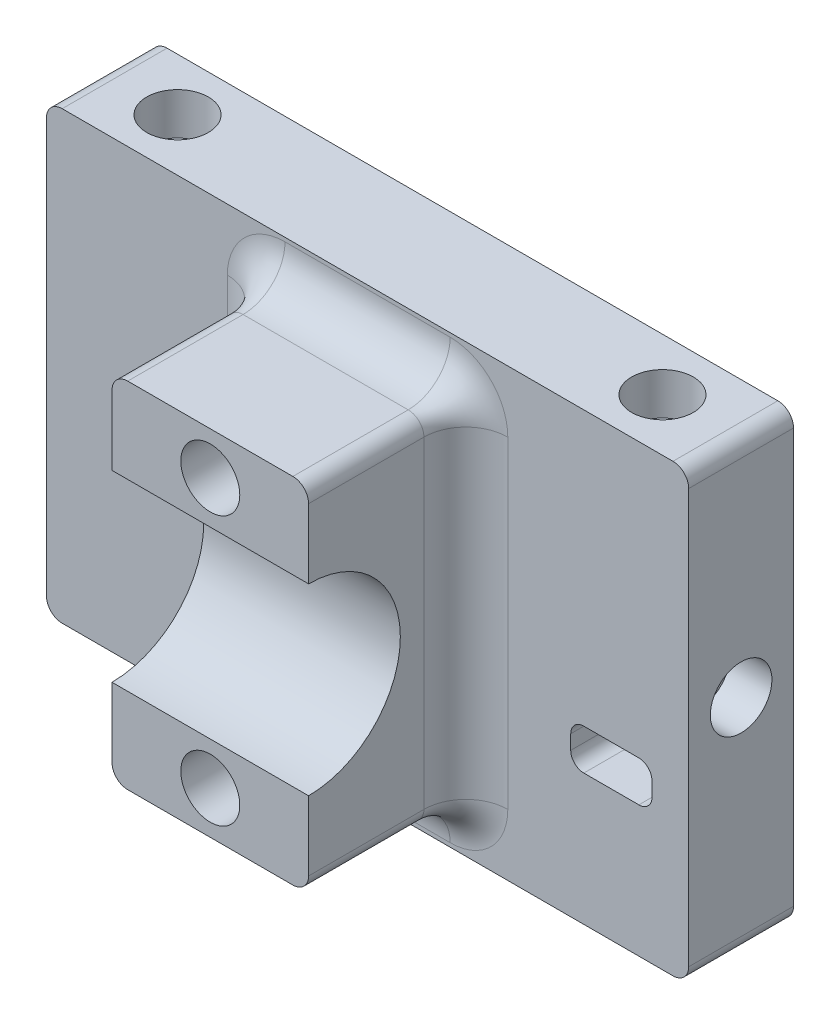
from build123d import *

# Parameters (mm, degrees)
ESQUISSE1_W                = 49
ESQUISSE1_H                = 34
BASE_DEPTH                 = 8
ESQUISSE2_R                = 2.35
INSERT_M3_L_DEPTH          = 3.2
INSERT_M3_R_START          = -3.2
ESQUISSE3_R                = 2.35
INSERT_M3_R_DEPTH          = 3.2
ESQUISSE4_R                = 2.35
INSERT_M3_TOP_DEPTH        = 3.2
INSER_M3_BOT_START         = 3.2
ESQUISSE5_R                = 2.35
INSER_M3_BOT_DEPTH         = 3.2
ESQUISSE11_R               = 1.5
PASSAGE_VIS_L_DEPTH        = 5
PASSAGE_VIS_R_START        = -5
ESQUISSE12_R               = 1.5
PASSAGE_VIS_R_DEPTH        = 5
ESQUISSE10_R               = 1.5
PASSAGE_VIS_TOP_DEPTH      = 5
PASSAGE_VIS_BOT_START      = -5
ESQUISSE13_R               = 1.5
PASSAGE_VIS_BOT_DEPTH      = 5
CONG_1_R                   = 1.2
ESQUISSE6_W                = 15
ESQUISSE6_H                = 27
SUPPORT_FIXATION_DEPTH     = 12
PASSAGE_GUIDON_REACH       = 43.388
CONG_VERTICAL_R            = 1.2
CONG_BASE_R                = 3.2
ESQUISSE8_R                = 2.25
INSERTS_M3_FIXATION_DEPTH  = 3.2
ESQUISSE9_R                = 1.5
PASSAGE_VIS_FIXATION_DEPTH = 5
PASSE_CABLE_DEPTH          = 8


with BuildPart() as part:
    # Esquisse1 → Base (new body)
    with BuildSketch(Plane.XY):
        Rectangle(ESQUISSE1_W, ESQUISSE1_H)
    extrude(amount=BASE_DEPTH)

    # Esquisse2 → Insert_M3_L (cut)
    with BuildSketch(Plane.ZY.offset(24.5)):
        with Locations(Location((4, 0, 0), (0, 0, 270))):
            Circle(ESQUISSE2_R)
    extrude(amount=-INSERT_M3_L_DEPTH, mode=Mode.SUBTRACT)

    # Esquisse3 → Insert_M3_R (cut)
    with BuildSketch(Plane(origin=(24.5, 0, 0), x_dir=(0, 0, -1), z_dir=(1, 0, 0)).offset(INSERT_M3_R_START)):
        with Locations(Location((-4, 0, 0), (0, 0, 270))):
            Circle(ESQUISSE3_R)
    extrude(amount=INSERT_M3_R_DEPTH, mode=Mode.SUBTRACT)

    # Esquisse4 → Insert_M3_TOP (cut)
    with BuildSketch(Plane(origin=(0, 17, 0), x_dir=(1, 0, 0), z_dir=(0, 1, 0))):
        with Locations(Location((-18.5, -4, 0), (0, 0, 180))):
            Circle(ESQUISSE4_R)
        with Locations(Location((18.5, -4, 0), (0, 0, 180))):
            Circle(ESQUISSE4_R)
    extrude(amount=-INSERT_M3_TOP_DEPTH, mode=Mode.SUBTRACT)

    # Esquisse5 → Inser_M3_BOT (cut)
    with BuildSketch(Plane(origin=(0, -17, -17), x_dir=(1, 0, 0), z_dir=(0, 1, 0)).offset(INSER_M3_BOT_START)):
        with Locations(Location((-18.5, -21, 0), (0, 0, 180))):
            Circle(ESQUISSE5_R)
        with Locations(Location((18.5, -21, 0), (0, 0, 180))):
            Circle(ESQUISSE5_R)
    extrude(amount=-INSER_M3_BOT_DEPTH, mode=Mode.SUBTRACT)

    # Esquisse11 → Passage_Vis_L (cut)
    with BuildSketch(Plane.ZY.offset(21.3)):
        with Locations(Location((4, 0, 0), (0, 0, 270))):
            Circle(ESQUISSE11_R)
    extrude(amount=-PASSAGE_VIS_L_DEPTH, mode=Mode.SUBTRACT)

    # Esquisse12 → Passage_Vis_R (cut)
    with BuildSketch(Plane(origin=(21.3, 0, 0), x_dir=(0, 0, -1), z_dir=(1, 0, 0)).offset(PASSAGE_VIS_R_START)):
        with Locations(Location((-4, 0, 0), (0, 0, 270))):
            Circle(ESQUISSE12_R)
    extrude(amount=PASSAGE_VIS_R_DEPTH, mode=Mode.SUBTRACT)

    # Esquisse10 → Passage_Vis_TOP (cut)
    with BuildSketch(Plane(origin=(0, 13.8, 0), x_dir=(1, 0, 0), z_dir=(0, 1, 0))):
        with Locations(Location((-18.5, -4, 0), (0, 0, 180))):
            Circle(ESQUISSE10_R)
        with Locations(Location((18.5, -4, 0), (0, 0, 180))):
            Circle(ESQUISSE10_R)
    extrude(amount=-PASSAGE_VIS_TOP_DEPTH, mode=Mode.SUBTRACT)

    # Esquisse13 → Passage_Vis_BOT (cut)
    with BuildSketch(Plane.XZ.offset(13.8).offset(PASSAGE_VIS_BOT_START)):
        with Locations(Location((-18.5, 4, 0), (0, 0, 180))):
            Circle(ESQUISSE13_R)
        with Locations(Location((18.5, 4, 0), (0, 0, 180))):
            Circle(ESQUISSE13_R)
    extrude(amount=PASSAGE_VIS_BOT_DEPTH, mode=Mode.SUBTRACT)

    # Congé1
    cong_1_edges = [part.edges().sort_by_distance(p)[0] for p in [
        (-24.5, 17, 4),
        (24.5, 17, 4),
        (24.5, -17, 4),
        (-24.5, -17, 4),
    ]]
    fillet(cong_1_edges, radius=CONG_1_R)

    # Esquisse6 → Support_Fixation (add)
    with BuildSketch(Plane.XY.offset(8)):
        Rectangle(ESQUISSE6_W, ESQUISSE6_H)
    extrude(amount=SUPPORT_FIXATION_DEPTH)

    # Esquisse7 → Passage_Guidon (cut, up to next)
    with BuildSketch(Plane.ZY.offset(7.5), mode=Mode.PRIVATE) as passage_guidon_sk1:
        with BuildLine():
            Line((20, 7), (20, -7))
            ThreePointArc((20, -7), (13, 0), (20, 7))
        make_face()
    passage_guidon_tool1 = extrude(passage_guidon_sk1.sketch, amount=-PASSAGE_GUIDON_REACH, mode=Mode.PRIVATE) & part.part
    add(passage_guidon_tool1.solids().sort_by_distance((-7.5, 0, 17.029108))[0], mode=Mode.SUBTRACT)

    # Congé_Vertical
    cong_vertical_edges = [part.edges().sort_by_distance(p)[0] for p in [
        (-7.5, 13.5, 14),
        (-7.5, -13.5, 14),
        (7.5, -13.5, 14),
        (7.5, 13.5, 14),
    ]]
    fillet(cong_vertical_edges, radius=CONG_VERTICAL_R)

    # Congé_Base
    cong_base_edges = [part.edges().sort_by_distance(p)[0] for p in [
        (-7.5, 0, 8),
        (0, 13.5, 8),
        (7.5, 0, 8),
        (0, -13.5, 8),
        (-7.148528137, 13.148528137, 8),
        (7.148528137, 13.148528137, 8),
        (7.148528137, -13.148528137, 8),
        (-7.148528137, -13.148528137, 8),
    ]]
    fillet(cong_base_edges, radius=CONG_BASE_R)

    # Esquisse8 → Inserts_M3_Fixation (cut)
    with BuildSketch(Plane.XY.offset(20)):
        with Locations((0, 10.25)):
            Circle(ESQUISSE8_R)
        with Locations(Location((0, -10.25, 0), (0, 0, 180))):
            Circle(ESQUISSE8_R)
    extrude(amount=-INSERTS_M3_FIXATION_DEPTH, mode=Mode.SUBTRACT)

    # Esquisse9 → Passage_Vis_Fixation (cut)
    with BuildSketch(Plane.XY.offset(16.8)):
        with Locations((0, 10.25)):
            Circle(ESQUISSE9_R)
        with Locations(Location((0, -10.25, 0), (0, 0, 180))):
            Circle(ESQUISSE9_R)
    extrude(amount=-PASSAGE_VIS_FIXATION_DEPTH, mode=Mode.SUBTRACT)

    # Esquisse14 → Passe_Cable (cut)
    with BuildSketch(Plane.XY.offset(8)):
        with BuildLine():
            Line((16.5, -3.9), (20.7, -3.9))
            ThreePointArc((20.7, -3.9), (21.407106781, -4.192893219), (21.7, -4.9))
            Line((21.7, -4.9), (21.7, -6))
            ThreePointArc((21.7, -6), (21.407106781, -6.707106781), (20.7, -7))
            Line((20.7, -7), (16.5, -7))
            ThreePointArc((16.5, -7), (15.792893219, -6.707106781), (15.5, -6))
            Line((15.5, -6), (15.5, -4.9))
            ThreePointArc((15.5, -4.9), (15.792893219, -4.192893219), (16.5, -3.9))
        make_face()
    extrude(amount=-PASSE_CABLE_DEPTH, mode=Mode.SUBTRACT)


solid = part.part
